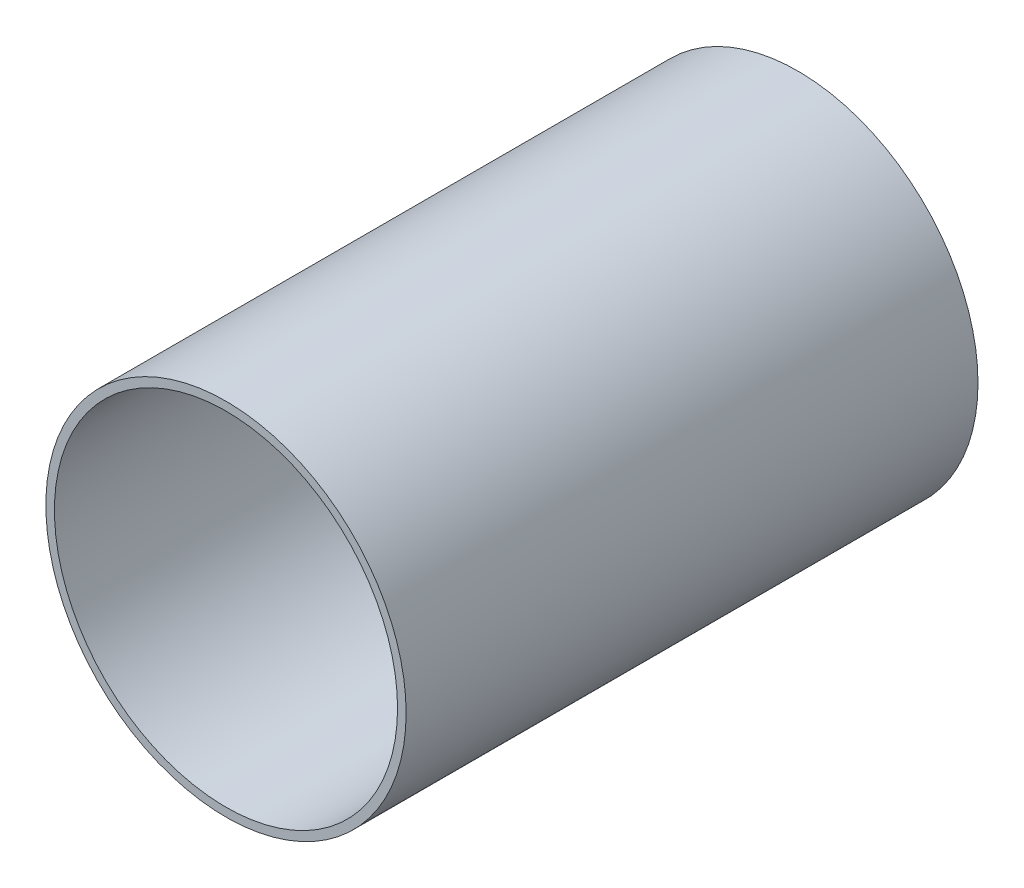
from build123d import *

# Parameters (mm, degrees)
ESQUISSE1_R        = 31.5
ESQUISSE1_R_2      = 30
BOSS_EXTRU_1_DEPTH = 100


with BuildPart() as part:
    # Esquisse1 → Boss.-Extru.1 (new body)
    with BuildSketch(Plane.XY):
        Circle(ESQUISSE1_R)
        Circle(ESQUISSE1_R_2, mode=Mode.SUBTRACT)
    extrude(amount=BOSS_EXTRU_1_DEPTH)


solid = part.part
